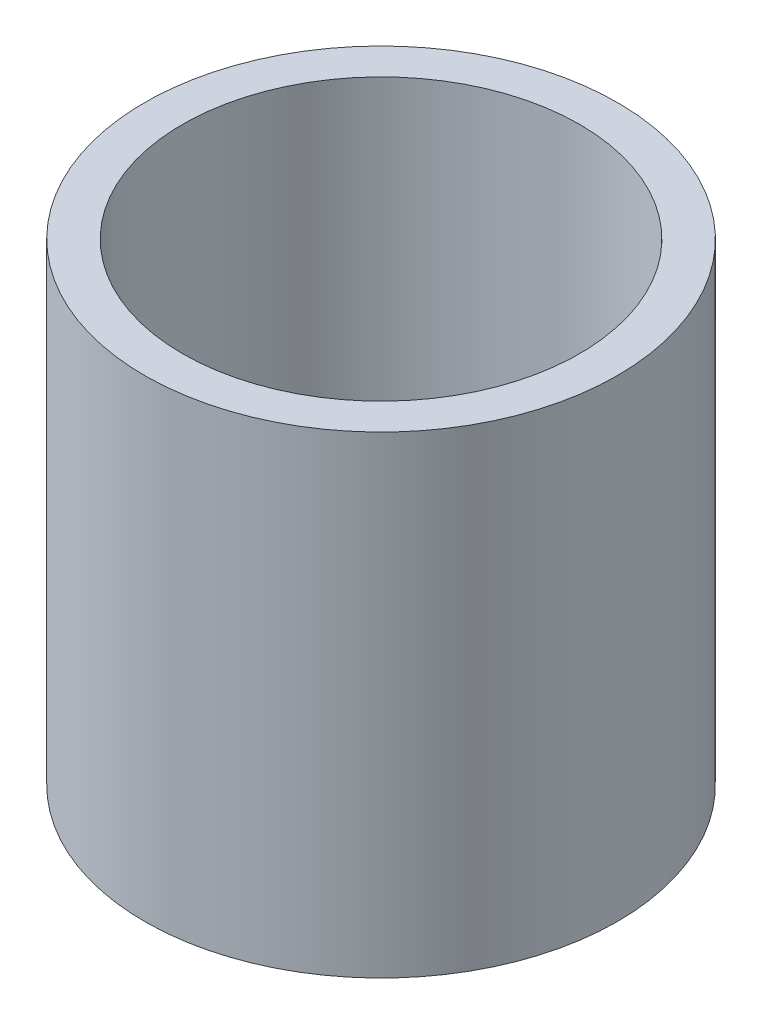
from build123d import *

# Parameters (mm, degrees)
SKETCH3_R           = 25
SKETCH3_R_2         = 21
EXTRUDE_THIN1_DEPTH = 50
SKETCH4_R           = 21
BOSS_EXTRUDE1_DEPTH = 4


with BuildPart() as part:
    # Sketch3 → Extrude-Thin1 (new body)
    with BuildSketch(Plane(origin=(0, 0, 0), x_dir=(1, 0, 0), z_dir=(0, 1, 0))):
        Circle(SKETCH3_R)
        Circle(SKETCH3_R_2, mode=Mode.SUBTRACT)
    extrude(amount=EXTRUDE_THIN1_DEPTH)

    # Sketch4 → Boss-Extrude1 (add)
    with BuildSketch(Plane(origin=(0, 0, 0), x_dir=(1, 0, 0), z_dir=(0, 1, 0))):
        with Locations(Location((0, 0, 0), (0, 0, 270))):
            Circle(SKETCH4_R)
    extrude(amount=BOSS_EXTRUDE1_DEPTH)


solid = part.part
